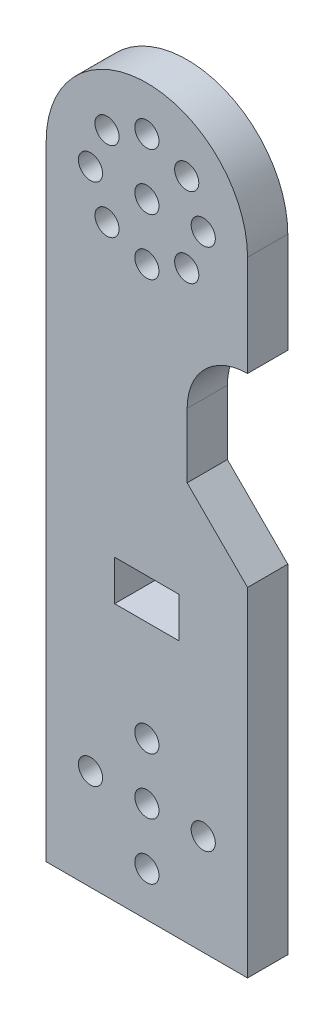
from build123d import *

# Parameters (mm, degrees)
SKETCH1_R           = 1.5
BOSS_EXTRUDE1_DEPTH = 5
SKETCH2_W           = 8
SKETCH2_H           = 5
CUT_EXTRUDE1_DEPTH  = 10
SKETCH3_R           = 1.5
CUT_EXTRUDE2_DEPTH  = 10
CUT_EXTRUDE4_DEPTH  = 10


with BuildPart() as part:
    # Sketch1 → Boss-Extrude1 (new body)
    with BuildSketch(Plane.XY):
        with BuildLine():
            Line((-12.5, 0), (-12.5, -77.5))
            Line((-12.5, -77.5), (12.5, -77.5))
            Line((12.5, -77.5), (12.5, 0))
            ThreePointArc((12.5, 0), (0, 12.5), (-12.5, 0))
        make_face()
        Circle(SKETCH1_R, mode=Mode.SUBTRACT)
        with Locations((0, 7)):
            Circle(SKETCH1_R, mode=Mode.SUBTRACT)
        with Locations((4.949747468, 4.949747468)):
            Circle(SKETCH1_R, mode=Mode.SUBTRACT)
        with Locations((7, 0)):
            Circle(SKETCH1_R, mode=Mode.SUBTRACT)
        with Locations((4.949747468, -4.949747468)):
            Circle(SKETCH1_R, mode=Mode.SUBTRACT)
        with Locations((0, -7)):
            Circle(SKETCH1_R, mode=Mode.SUBTRACT)
        with Locations((-4.949747468, -4.949747468)):
            Circle(SKETCH1_R, mode=Mode.SUBTRACT)
        with Locations((-7, 0)):
            Circle(SKETCH1_R, mode=Mode.SUBTRACT)
        with Locations((-4.949747468, 4.949747468)):
            Circle(SKETCH1_R, mode=Mode.SUBTRACT)
    extrude(amount=BOSS_EXTRUDE1_DEPTH)

    # Sketch2 → Cut-Extrude1 (cut)
    with BuildSketch(Plane.XY.offset(5)):
        with Locations((0, -43)):
            Rectangle(SKETCH2_W, SKETCH2_H)
    extrude(amount=-CUT_EXTRUDE1_DEPTH, mode=Mode.SUBTRACT)

    # Sketch3 → Cut-Extrude2 (cut)
    with BuildSketch(Plane.XY.offset(5)):
        with Locations((0, -65)):
            Circle(SKETCH3_R)
        with Locations((0, -58)):
            Circle(SKETCH3_R)
        with Locations((-7, -65)):
            Circle(SKETCH3_R)
        with Locations((7, -65)):
            Circle(SKETCH3_R)
        with Locations((0, -72)):
            Circle(SKETCH3_R)
    extrude(amount=-CUT_EXTRUDE2_DEPTH, mode=Mode.SUBTRACT)

    # Sketch4 → Cut-Extrude4 (cut)
    with BuildSketch(Plane.XY.offset(5)):
        with BuildLine():
            Line((5, -20), (5, -28))
            Line((5, -28), (12.5, -35.5))
            Line((12.5, -35.5), (12.5, -27.5))
            ThreePointArc((12.5, -27.5), (17.803300859, -14.696699141), (5, -20))
        make_face()
    extrude(amount=-CUT_EXTRUDE4_DEPTH, mode=Mode.SUBTRACT)


solid = part.part
